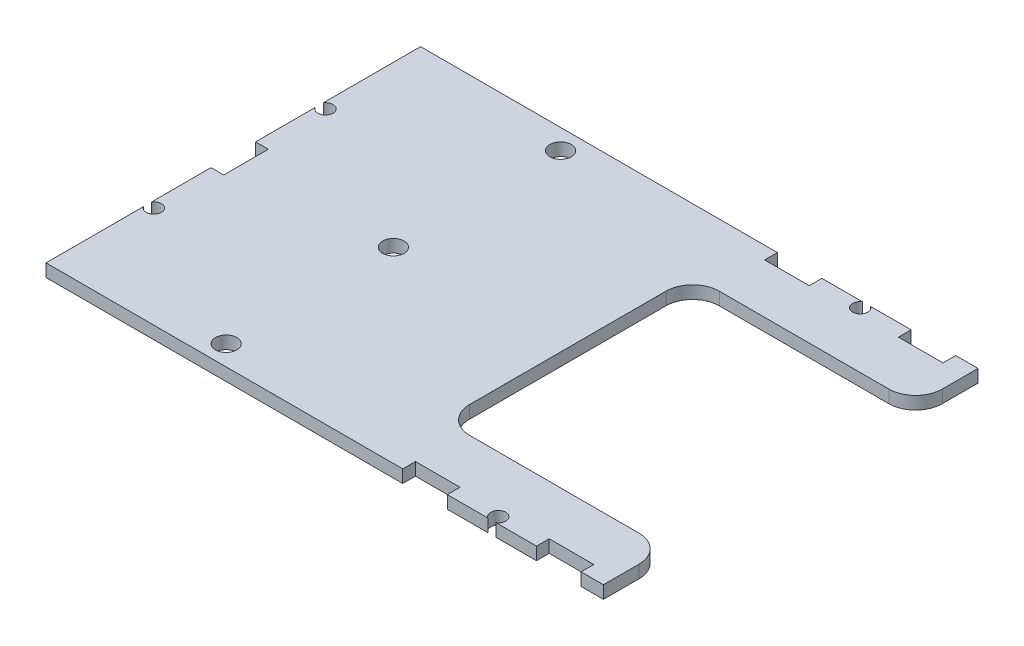
from build123d import *

# Parameters (mm, degrees)
SKETCH1_W           = 125
SKETCH1_H           = 84
BOSS_EXTRUDE1_DEPTH = 2.85
SKETCH2_R           = 1.5
CUT_EXTRUDE1_DEPTH  = 76.354976611
SKETCH3_R           = 2.4
CUT_EXTRUDE2_DEPTH  = 76.354976611
SKETCH4_R           = 1.7
SKETCH4_W           = 2.85
SKETCH4_H           = 10
CUT_EXTRUDE3_DEPTH  = 76.354976611
SKETCH5_R           = 1.7
SKETCH5_W           = 10
SKETCH5_H           = 2.85
CUT_EXTRUDE4_DEPTH  = 76.354976611
SKETCH6_W           = 50
SKETCH6_H           = 56
CUT_EXTRUDE5_DEPTH  = 76.354976611
FILLET1_R           = 6


with BuildPart() as part:
    # Sketch1 → Boss-Extrude1 (new body)
    with BuildSketch(Plane(origin=(0, 0, 0), x_dir=(1, 0, 0), z_dir=(0, 1, 0))):
        Rectangle(SKETCH1_W, SKETCH1_H)
    extrude(amount=BOSS_EXTRUDE1_DEPTH)

    # Sketch2 → Cut-Extrude1 (cut, through all)
    with BuildSketch(Plane.XZ):
        with Locations(Location((44.5, 0, 0), (0, 0, 270))):
            Circle(SKETCH2_R)
    extrude(amount=-CUT_EXTRUDE1_DEPTH, mode=Mode.SUBTRACT)

    # Sketch3 → Cut-Extrude2 (cut, through all)
    with BuildSketch(Plane(origin=(0, 2.85, 0), x_dir=(1, 0, 0), z_dir=(0, 1, 0))):
        with Locations(Location((-26.6, 0, 0), (0, 0, 270))):
            Circle(SKETCH3_R)
        with Locations(Location((-26.6, 37.5, 0), (0, 0, 270))):
            Circle(SKETCH3_R)
        with Locations(Location((-26.6, -37.5, 0), (0, 0, 270))):
            Circle(SKETCH3_R)
    extrude(amount=-CUT_EXTRUDE2_DEPTH, mode=Mode.SUBTRACT)

    # Sketch4 → Cut-Extrude3 (cut, through all)
    with BuildSketch(Plane(origin=(0, 2.85, 0), x_dir=(1, 0, 0), z_dir=(0, 1, 0))):
        with Locations((-61.075, -19.25)):
            Circle(SKETCH4_R)
        with Locations((-61.075, 19.25)):
            Circle(SKETCH4_R)
        with Locations((-61.075, 0)):
            Rectangle(SKETCH4_W, SKETCH4_H)
    extrude(amount=-CUT_EXTRUDE3_DEPTH, mode=Mode.SUBTRACT)

    # Sketch5 → Cut-Extrude4 (cut, through all)
    with BuildSketch(Plane(origin=(0, 2.85, 0), x_dir=(1, 0, 0), z_dir=(0, 1, 0))):
        with Locations((37.5, 40.575)):
            Circle(SKETCH5_R)
        with Locations((52.5, 40.575)):
            Rectangle(SKETCH5_W, SKETCH5_H)
        with Locations((22.5, 40.575)):
            Rectangle(SKETCH5_W, SKETCH5_H)
    cut_extrude4 = extrude(amount=-CUT_EXTRUDE4_DEPTH, mode=Mode.SUBTRACT)

    # Mirror1: Cut-Extrude4 across plane
    add(cut_extrude4.mirror(Plane.XY), mode=Mode.SUBTRACT)

    # Sketch6 → Cut-Extrude5 (cut, through all)
    with BuildSketch(Plane(origin=(0, 2.85, 0), x_dir=(1, 0, 0), z_dir=(0, 1, 0))):
        with Locations((37.5, 0)):
            Rectangle(SKETCH6_W, SKETCH6_H)
    extrude(amount=-CUT_EXTRUDE5_DEPTH, mode=Mode.SUBTRACT)

    # Fillet1
    fillet1_edges = [part.edges().sort_by_distance(p)[0] for p in [
        (62.5, 1.425, -28),
        (62.5, 1.425, 28),
        (12.5, 1.425, 28),
        (12.5, 1.425, -28),
    ]]
    fillet(fillet1_edges, radius=FILLET1_R)


solid = part.part
